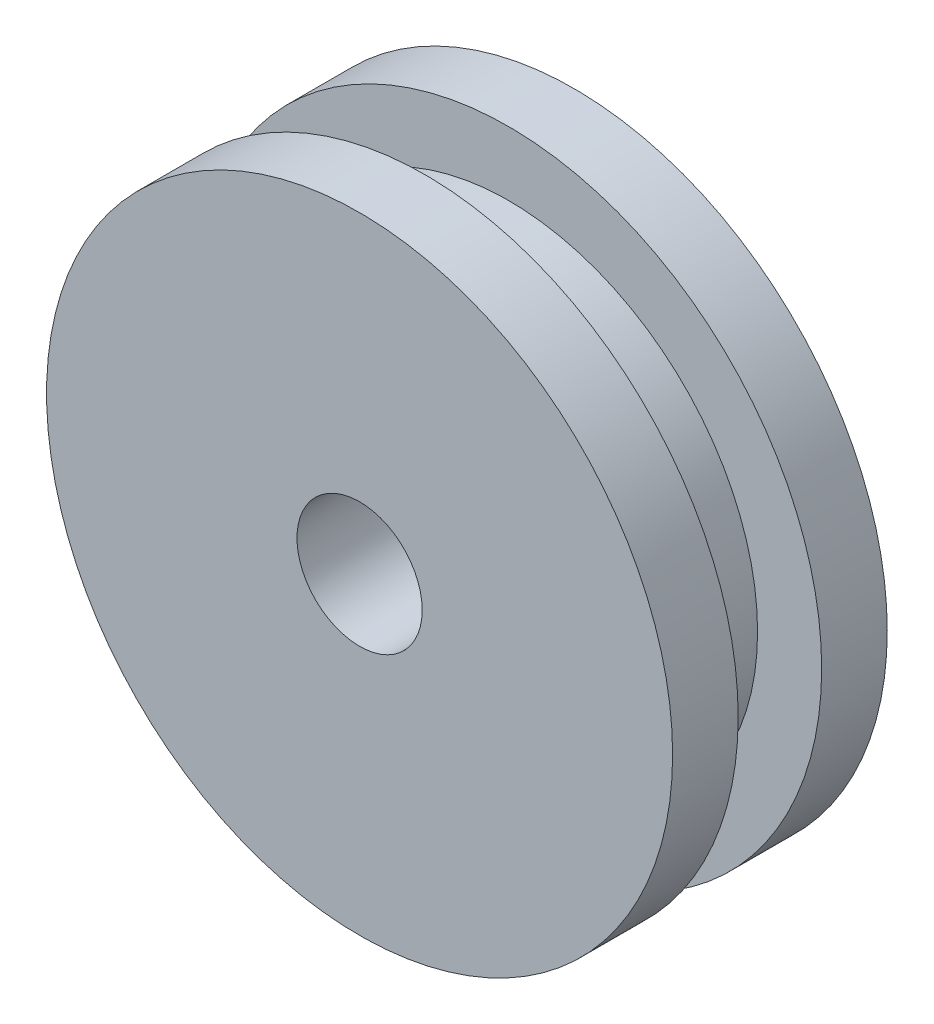
from build123d import *

# Parameters (mm, degrees)
F_01_START                           = -1.4
S01_GROOVE_ROOT_AND_AXLE_BORE_R      = 8.35
S01_GROOVE_ROOT_AND_AXLE_BORE_R_2    = 2.1
F_01_GROOVE_ROOT_AND_AXLE_BORE_DEPTH = 2.8
F_02_START                           = -3.6
S02_RETAINING_FLANGE_3_6_R           = 10.5
S02_RETAINING_FLANGE_3_6_R_2         = 2.1
F_02_RETAINING_FLANGE_3_6_DEPTH      = 2.2
F_03_START                           = 1.4
S03_RETAINING_FLANGE_1_4_R           = 10.5
S03_RETAINING_FLANGE_1_4_R_2         = 2.1
F_03_RETAINING_FLANGE_1_4_DEPTH      = 2.2


with BuildPart() as part:
    # S01 - Groove root and axle bore → 01 - Groove root and axle bore (new body)
    with BuildSketch(Plane.XY.offset(F_01_START)):
        Circle(S01_GROOVE_ROOT_AND_AXLE_BORE_R)
        Circle(S01_GROOVE_ROOT_AND_AXLE_BORE_R_2, mode=Mode.SUBTRACT)
    extrude(amount=F_01_GROOVE_ROOT_AND_AXLE_BORE_DEPTH)

    # S02 - Retaining flange -3.6 → 02 - Retaining flange -3.6 (add)
    with BuildSketch(Plane.XY.offset(F_02_START)):
        Circle(S02_RETAINING_FLANGE_3_6_R)
        Circle(S02_RETAINING_FLANGE_3_6_R_2, mode=Mode.SUBTRACT)
    extrude(amount=F_02_RETAINING_FLANGE_3_6_DEPTH)

    # S03 - Retaining flange 1.4 → 03 - Retaining flange 1.4 (add)
    with BuildSketch(Plane.XY.offset(F_03_START)):
        Circle(S03_RETAINING_FLANGE_1_4_R)
        Circle(S03_RETAINING_FLANGE_1_4_R_2, mode=Mode.SUBTRACT)
    extrude(amount=F_03_RETAINING_FLANGE_1_4_DEPTH)


solid = part.part
